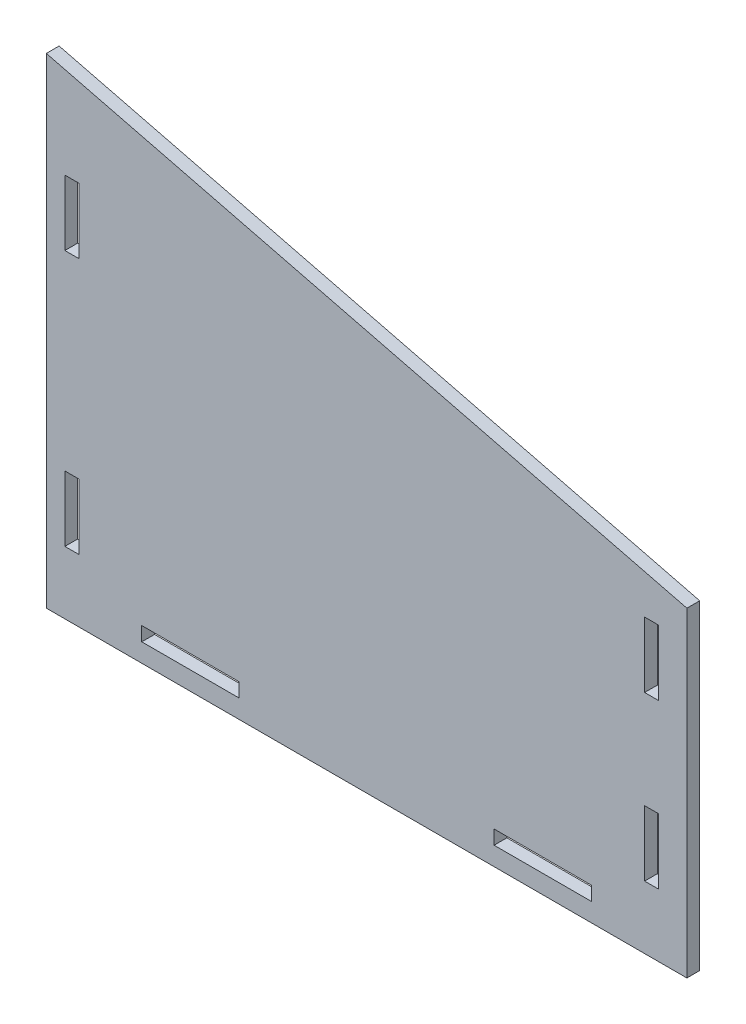
from build123d import *

# Parameters (mm, degrees)
SKETCH_1_W      = 4.4
SKETCH_1_H      = 20.4
SKETCH_1_W_2    = 30.4
SKETCH_1_H_2    = 4.4
EXTRUDE_1_DEPTH = 4


with BuildPart() as part:
    # Эскиз1 → Бобышка-Вытянуть1 (new body)
    with BuildSketch(Plane.XY):
        Polygon((0, 0), (0, 150), (200, 100), (200, 0), align=None)
        with Locations((189, 29.8)):
            Rectangle(SKETCH_1_W, SKETCH_1_H, mode=Mode.SUBTRACT)
        with Locations((155, 8)):
            Rectangle(SKETCH_1_W_2, SKETCH_1_H_2, mode=Mode.SUBTRACT)
        with Locations((45, 8)):
            Rectangle(SKETCH_1_W_2, SKETCH_1_H_2, mode=Mode.SUBTRACT)
        with Locations((8, 109.8)):
            Rectangle(SKETCH_1_W, SKETCH_1_H, mode=Mode.SUBTRACT)
        with Locations((189, 80.8)):
            Rectangle(SKETCH_1_W, SKETCH_1_H, mode=Mode.SUBTRACT)
        with Locations((8, 29.8)):
            Rectangle(SKETCH_1_W, SKETCH_1_H, mode=Mode.SUBTRACT)
    extrude(amount=EXTRUDE_1_DEPTH)


solid = part.part
